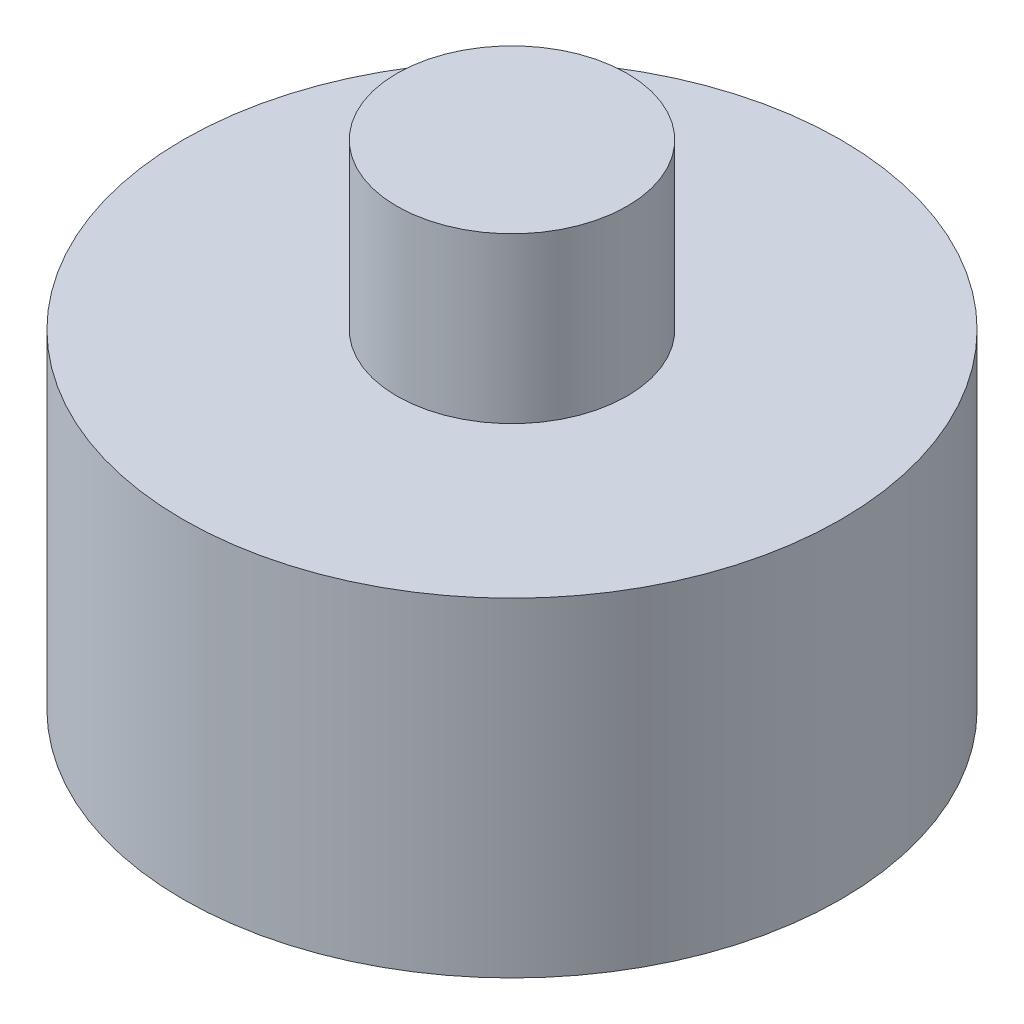
from build123d import *

# Parameters (mm, degrees)
SKETCH2_R           = 10
BOSS_EXTRUDE1_DEPTH = 10
SKETCH3_R           = 3.5
BOSS_EXTRUDE3_DEPTH = 5


with BuildPart() as part:
    # Sketch2 → Boss-Extrude1 (new body)
    with BuildSketch(Plane(origin=(0, 0, 0), x_dir=(1, 0, 0), z_dir=(0, 1, 0))):
        with Locations(Location((0, 0, 0), (0, 0, 270))):
            Circle(SKETCH2_R)
    extrude(amount=BOSS_EXTRUDE1_DEPTH)

    # Sketch3 → Boss-Extrude3 (add)
    with BuildSketch(Plane(origin=(0, 10, 0), x_dir=(1, 0, 0), z_dir=(0, 1, 0))):
        with Locations(Location((0, 0, 0), (0, 0, 270))):
            Circle(SKETCH3_R)
    extrude(amount=BOSS_EXTRUDE3_DEPTH)


solid = part.part
